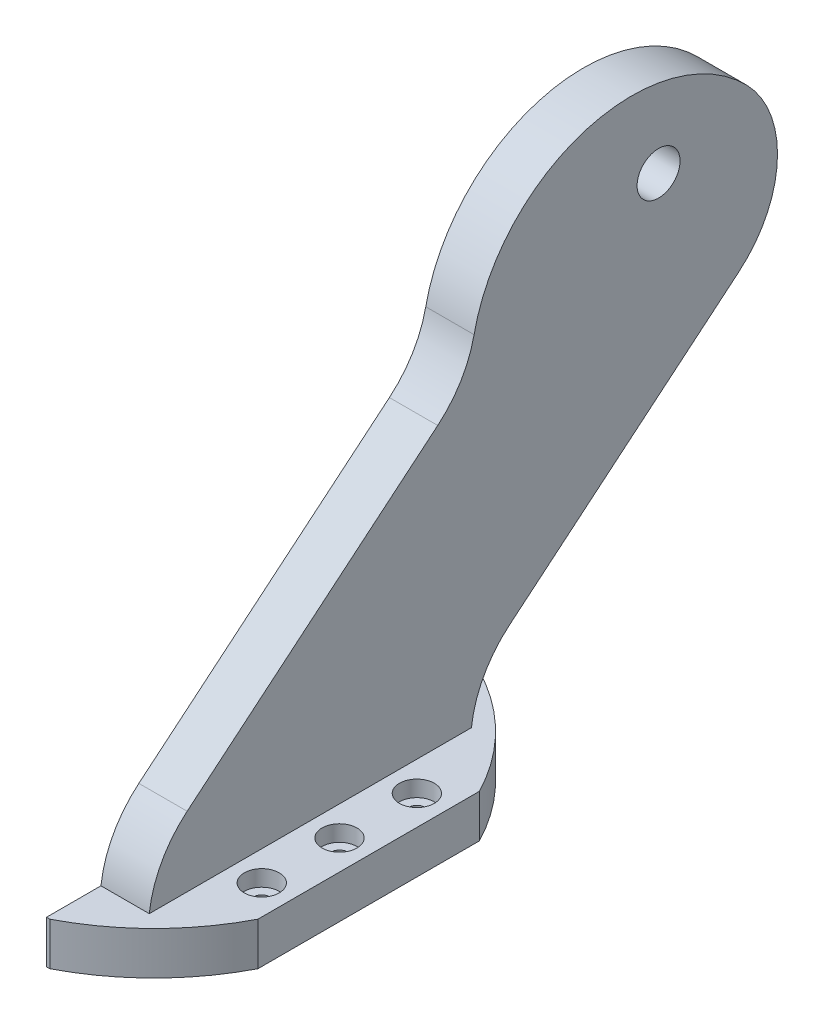
from build123d import *

# Parameters (mm, degrees)
SALIENTE_EXTRUIR2_DEPTH = 8
CORTAR_EXTRUIR1_DEPTH   = 8
CROQUIS4_R              = 4
SALIENTE_EXTRUIR3_DEPTH = 13
CROQUIS5_W              = 11
CROQUIS5_H              = 133.016244933
CORTAR_EXTRUIR2_DEPTH   = 87
CROQUIS7_R              = 1.5
CORTAR_EXTRUIR3_DEPTH   = 87
CROQUIS8_R              = 3.25
CORTAR_EXTRUIR4_DEPTH   = 3


with BuildPart() as part:
    # Croquis1 → Saliente-Extruir2 (new body)
    with BuildSketch(Plane(origin=(0, 0, 0), x_dir=(1, 0, 0), z_dir=(0, 1, 0))):
        Polygon((0, 0), (0, 40), (20, 40), (20, -40), (0, -40), align=None)
    extrude(amount=SALIENTE_EXTRUIR2_DEPTH)

    # Croquis3 → Cortar-Extruir1 (cut)
    with BuildSketch(Plane(origin=(0, 8, 0), x_dir=(1, 0, 0), z_dir=(0, 1, 0))):
        with BuildLine():
            Line((20, 40), (0.615528128, 40))
            ThreePointArc((0.615528128, 40), (11.819805153, 31.819805153), (20, 20.615528128))
            Line((20, 20.615528128), (20, 40))
        make_face()
        with BuildLine():
            ThreePointArc((20, -20.615528128), (11.819805153, -31.819805153), (0.615528128, -40))
            Line((0.615528128, -40), (20, -40))
            Line((20, -40), (20, -20.615528128))
        make_face()
    extrude(amount=-CORTAR_EXTRUIR1_DEPTH, mode=Mode.SUBTRACT)

    # Croquis4 → Saliente-Extruir3 (add)
    with BuildSketch(Plane(origin=(0, 0, 0), x_dir=(0, 0, -1), z_dir=(1, 0, 0))):
        with BuildLine():
            Line((0, 0), (-30, 0))
            Line((-30, 0), (-30, 5.63250108))
            ThreePointArc((-30, 5.63250108), (-28.111788424, 14.115609005), (-22.803687993, 20.996926672))
            Line((-22.803687993, 20.996926672), (23.866202653, 59.88850221))
            ThreePointArc((23.866202653, 59.88850221), (28.203401142, 64.948074064), (30.637508796, 71.151756681))
            ThreePointArc((30.637508796, 71.151756681), (51.597737237, 93.799339931), (81.447972358, 85.975807058))
            ThreePointArc((81.447972358, 85.975807058), (87.123427128, 70.974483465), (79.953012113, 56.627510094))
            Line((79.953012113, 56.627510094), (37.196312007, 20.996926672))
            ThreePointArc((37.196312007, 20.996926672), (31.888211576, 14.115609005), (30, 5.63250108))
            Line((30, 5.63250108), (30, 0))
            Line((30, 0), (0, 0))
        make_face()
        with Locations(Location((65, 80, 0), (0, 0, 180))):
            Circle(CROQUIS4_R, mode=Mode.SUBTRACT)
    extrude(amount=SALIENTE_EXTRUIR3_DEPTH)

    # Croquis5 → Cortar-Extruir2 (cut)
    with BuildSketch(Plane(origin=(0, 95, 0), x_dir=(1, 0, 0), z_dir=(0, 1, 0))):
        with Locations((14.5, 20.641201652)):
            Rectangle(CROQUIS5_W, CROQUIS5_H)
    extrude(amount=-CORTAR_EXTRUIR2_DEPTH, mode=Mode.SUBTRACT)

    # Croquis7 → Cortar-Extruir3 (cut)
    with BuildSketch(Plane(origin=(0, 8, 0), x_dir=(1, 0, 0), z_dir=(0, 1, 0))):
        with Locations(Location((14.5, 14.481175371, 0), (0, 0, 270))):
            Circle(CROQUIS7_R)
        with Locations(Location((14.5, 0.070310316, 0), (0, 0, 270))):
            Circle(CROQUIS7_R)
        with Locations(Location((14.5, -14.410865055, 0), (0, 0, 270))):
            Circle(CROQUIS7_R)
    extrude(amount=-CORTAR_EXTRUIR3_DEPTH, mode=Mode.SUBTRACT)

    # Croquis8 → Cortar-Extruir4 (cut)
    with BuildSketch(Plane(origin=(0, 8, 0), x_dir=(1, 0, 0), z_dir=(0, 1, 0))):
        with Locations(Location((14.5, 14.481175371, 0), (0, 0, 270))):
            Circle(CROQUIS8_R)
        with Locations(Location((14.5, 0.070310316, 0), (0, 0, 270))):
            Circle(CROQUIS8_R)
        with Locations(Location((14.5, -14.410865055, 0), (0, 0, 270))):
            Circle(CROQUIS8_R)
    extrude(amount=-CORTAR_EXTRUIR4_DEPTH, mode=Mode.SUBTRACT)


solid = part.part
